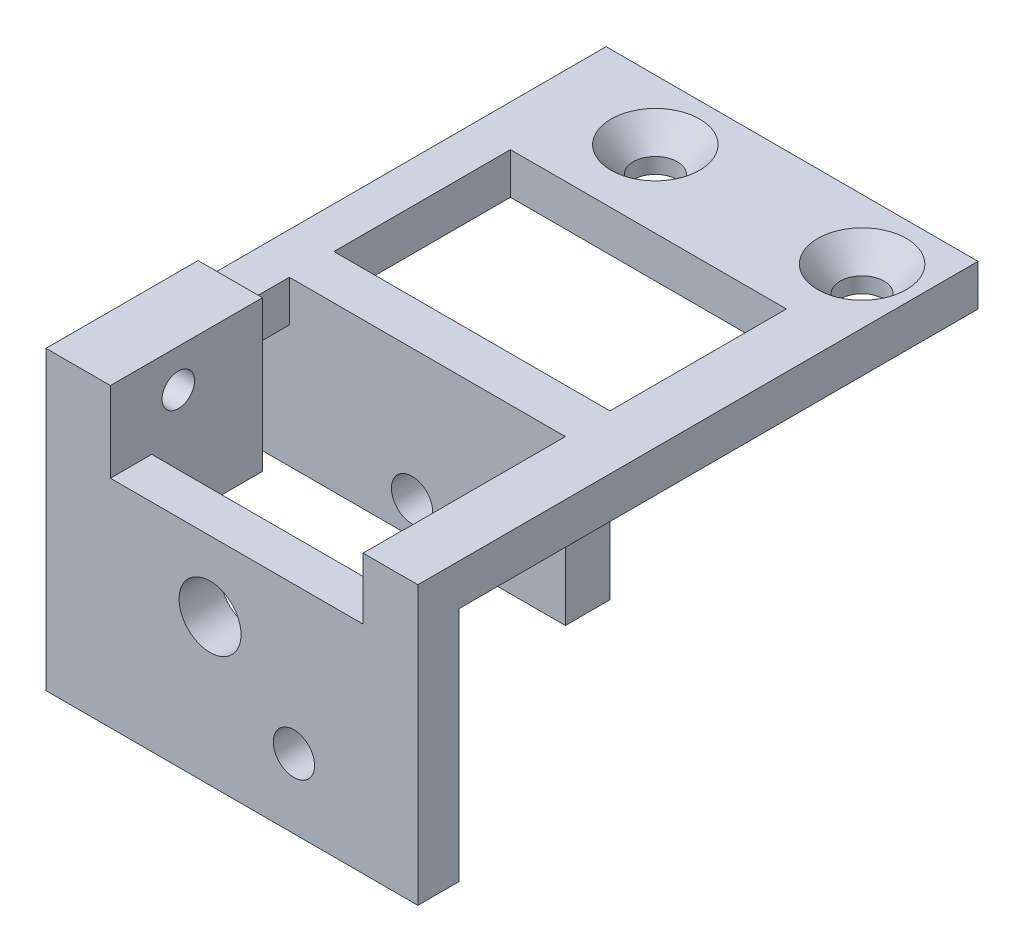
from build123d import *

# Parameters (mm, degrees)
SKETCH1_R                                        = 3.175
SKETCH1_R_2                                      = 4.762499999
BOSS_EXTRUDE1_DEPTH                              = 6.35
BOSS_EXTRUDE2_DEPTH                              = 23.368
SKETCH3_W                                        = 6.35
SKETCH3_H                                        = 78.34
SKETCH3_W_2                                      = 8.382
BOSS_EXTRUDE3_DEPTH                              = 6.35
CUT_EXTRUDE1_REACH                               = 104.101
SKETCH4_R                                        = 2.5
BOSS_EXTRUDE4_DEPTH                              = 6.35
CSK_FOR_1_4_FLAT_HEAD_MACHINE_SCREW1_D           = 6.7564
CSK_FOR_1_4_FLAT_HEAD_MACHINE_SCREW1_CSINK_D     = 13.6398
CSK_FOR_1_4_FLAT_HEAD_MACHINE_SCREW1_CSINK_ANGLE = 82
SKETCH8_W                                        = 48.768
SKETCH8_H                                        = 6.843039895
BOSS_EXTRUDE5_DEPTH                              = 25.146
CUT_EXTRUDE2_REACH                               = 68.059
SKETCH10_R                                       = 3.175


with BuildPart() as part:
    # Sketch1 → Boss-Extrude1 (new body)
    with BuildSketch(Plane.XY):
        Polygon((23.52260518, 29.069744957), (31.942128684, 29.069744957), (31.942128684, -13.602255043), (-25.207871316, -13.602255043), (-25.207871316, 8.844196721), (-25.207871316, 31.958196721), (-18.857871316, 31.958196721), (-15.310946905, 31.958196721), (-15.310946905, 22.656471706), (-15.310946905, 19.620299994), (23.52260518, 19.620299994), (23.52260518, 22.656471706), align=None)
        with Locations((12.892128684, -2.934255043)):
            Circle(SKETCH1_R, mode=Mode.SUBTRACT)
        with Locations((6.7e-08, 8.844196721)):
            Circle(SKETCH1_R_2, mode=Mode.SUBTRACT)
    extrude(amount=-BOSS_EXTRUDE1_DEPTH)

    # Sketch2 → Boss-Extrude2 (add)
    with BuildSketch(Plane.XY):
        Polygon((-15.310946905, 31.958196721), (-18.857871316, 31.958196721), (-25.207871316, 31.958196721), (-25.207871316, 8.844196721), (-18.857871316, 8.844196721), (-15.310946905, 8.844196721), (-15.310946905, 19.620299994), align=None)
    extrude(amount=-BOSS_EXTRUDE2_DEPTH)

    # Sketch3 → Boss-Extrude3 (add)
    with BuildSketch(Plane(origin=(0, 29.069744957, 0), x_dir=(1, 0, 0), z_dir=(0, 1, 0))):
        with Locations((-22.032871316, 39.17)):
            Rectangle(SKETCH3_W, SKETCH3_H)
        with Locations((27.751128684, 39.17)):
            Rectangle(SKETCH3_W_2, SKETCH3_H)
    extrude(amount=-BOSS_EXTRUDE3_DEPTH)

    # Sketch4 → Cut-Extrude1 (cut, up to next)
    with BuildSketch(Plane.ZY.offset(25.207871316), mode=Mode.PRIVATE) as cut_extrude1_sk1:
        with Locations(Location((-10.437499124, 26.162307082, 0), (0, 0, 270))):
            Circle(SKETCH4_R)
    cut_extrude1_tool1 = extrude(cut_extrude1_sk1.sketch, amount=-CUT_EXTRUDE1_REACH, mode=Mode.PRIVATE) & part.part
    add(cut_extrude1_tool1.solids().sort_by_distance((-25.207871, 26.162307, -10.437499))[0], mode=Mode.SUBTRACT)

    # Sketch5 → Boss-Extrude4 (add)
    with BuildSketch(Plane(origin=(0, 29.069744957, 0), x_dir=(1, 0, 0), z_dir=(0, 1, 0))):
        Polygon((-25.207871316, 78.34), (-25.207871316, 65.022649662), (31.942128684, 65.022649662), (31.942128684, 78.34), (31.942128684, 86.081334737), (-25.207871316, 86.081334737), align=None)
    extrude(amount=-BOSS_EXTRUDE4_DEPTH)

    # CSK for 1/4 Flat Head Machine Screw1 (through all)
    with Locations(Plane(origin=(0, 29.069744957, 0), x_dir=(1, 0, 0), z_dir=(0, 1, 0))):
        with Locations((-8.384740386, 76.819020678), (23.394249394, 76.819020678)):
            CounterSinkHole(CSK_FOR_1_4_FLAT_HEAD_MACHINE_SCREW1_D / 2, CSK_FOR_1_4_FLAT_HEAD_MACHINE_SCREW1_CSINK_D / 2, counter_sink_angle=CSK_FOR_1_4_FLAT_HEAD_MACHINE_SCREW1_CSINK_ANGLE)

    # Sketch8 → Boss-Extrude5 (add)
    with BuildSketch(Plane(origin=(0, 29.069744957, 0), x_dir=(1, 0, 0), z_dir=(0, 1, 0))):
        with Locations((-0.823871316, 34.471519947)):
            Rectangle(SKETCH8_W, SKETCH8_H)
    extrude(amount=-BOSS_EXTRUDE5_DEPTH)

    # Sketch10 → Cut-Extrude2 (cut, up to next)
    with BuildSketch(Plane(origin=(0, 0, -37.893039895), x_dir=(-1, 0, 0), z_dir=(0, 0, -1)), mode=Mode.PRIVATE) as cut_extrude2_sk1:
        with Locations((-6.7e-08, 8.844196721)):
            Circle(SKETCH10_R)
    cut_extrude2_tool1 = extrude(cut_extrude2_sk1.sketch, amount=-CUT_EXTRUDE2_REACH, mode=Mode.PRIVATE) & part.part
    add(cut_extrude2_tool1.solids().sort_by_distance((0, 8.844197, -37.89304))[0], mode=Mode.SUBTRACT)


solid = part.part
